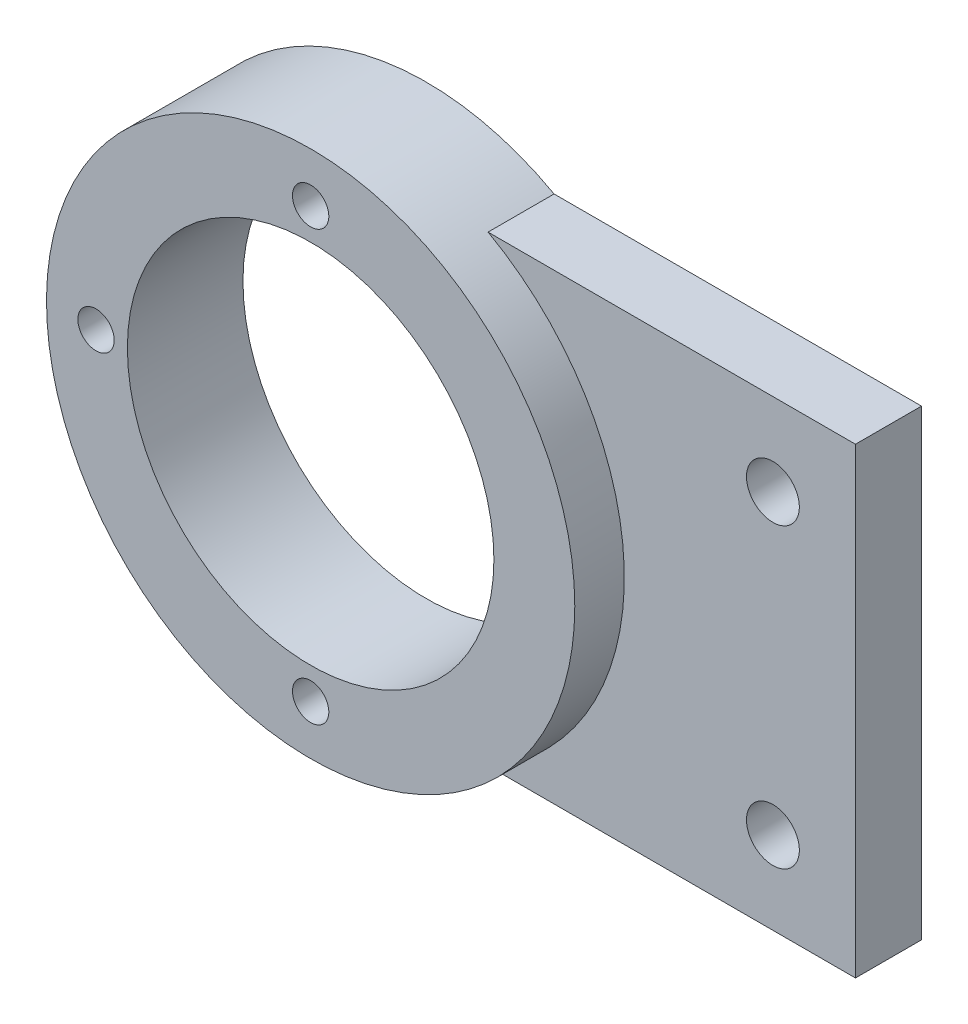
from build123d import *

# Parameters (mm, degrees)
BEARING_HOUSING_PROFILE_R          = 16
BEARING_HOUSING_PROFILE_R_2        = 11.1
BEARING_HOUSING_DEPTH              = 7
MOUNTING_WEB_PROFILE_W             = 30
MOUNTING_WEB_PROFILE_H             = 28
MOUNTING_WEB_DEPTH                 = 4
BEARING_SEAT_START                 = -50
BEARING_SEAT_PROFILE_R             = 11.1
BEARING_SEAT_DEPTH                 = 85.713109915
STANDOFF_FASTENERS_START           = -50
STANDOFF_FASTENERS_PROFILE_R       = 1.6
STANDOFF_FASTENERS_DEPTH           = 85.713109915
BEARING_KEEPER_FASTENERS_START     = -50
BEARING_KEEPER_FASTENERS_PROFILE_R = 1.1
BEARING_KEEPER_FASTENERS_DEPTH     = 85.713109915


with BuildPart() as part:
    # Bearing_housing_profile → Bearing_housing (new body)
    with BuildSketch(Plane.XY):
        Circle(BEARING_HOUSING_PROFILE_R)
        Circle(BEARING_HOUSING_PROFILE_R_2, mode=Mode.SUBTRACT)
    extrude(amount=BEARING_HOUSING_DEPTH)

    # Mounting_web_profile → Mounting_web (add)
    with BuildSketch(Plane.XY):
        with Locations((15, 0)):
            Rectangle(MOUNTING_WEB_PROFILE_W, MOUNTING_WEB_PROFILE_H)
    extrude(amount=MOUNTING_WEB_DEPTH)

    # Bearing_seat_profile → Bearing_seat (cut, through all)
    with BuildSketch(Plane.XY.offset(BEARING_SEAT_START)):
        Circle(BEARING_SEAT_PROFILE_R)
    extrude(amount=BEARING_SEAT_DEPTH, mode=Mode.SUBTRACT)

    # Standoff_fasteners_profile → Standoff_fasteners (cut, through all)
    with BuildSketch(Plane.XY.offset(STANDOFF_FASTENERS_START)):
        with Locations(Location((25, -9, 0), (0, 0, 180))):
            Circle(STANDOFF_FASTENERS_PROFILE_R)
        with Locations(Location((25, 9, 0), (0, 0, 180))):
            Circle(STANDOFF_FASTENERS_PROFILE_R)
    extrude(amount=STANDOFF_FASTENERS_DEPTH, mode=Mode.SUBTRACT)

    # Bearing_keeper_fasteners_profile → Bearing_keeper_fasteners (cut, through all)
    with BuildSketch(Plane.XY.offset(BEARING_KEEPER_FASTENERS_START)):
        with Locations(Location((-13, 0, 0), (0, 0, 180))):
            Circle(BEARING_KEEPER_FASTENERS_PROFILE_R)
        with Locations(Location((0, -13, 0), (0, 0, 180))):
            Circle(BEARING_KEEPER_FASTENERS_PROFILE_R)
        with Locations(Location((0, 13, 0), (0, 0, 180))):
            Circle(BEARING_KEEPER_FASTENERS_PROFILE_R)
    extrude(amount=BEARING_KEEPER_FASTENERS_DEPTH, mode=Mode.SUBTRACT)


solid = part.part
